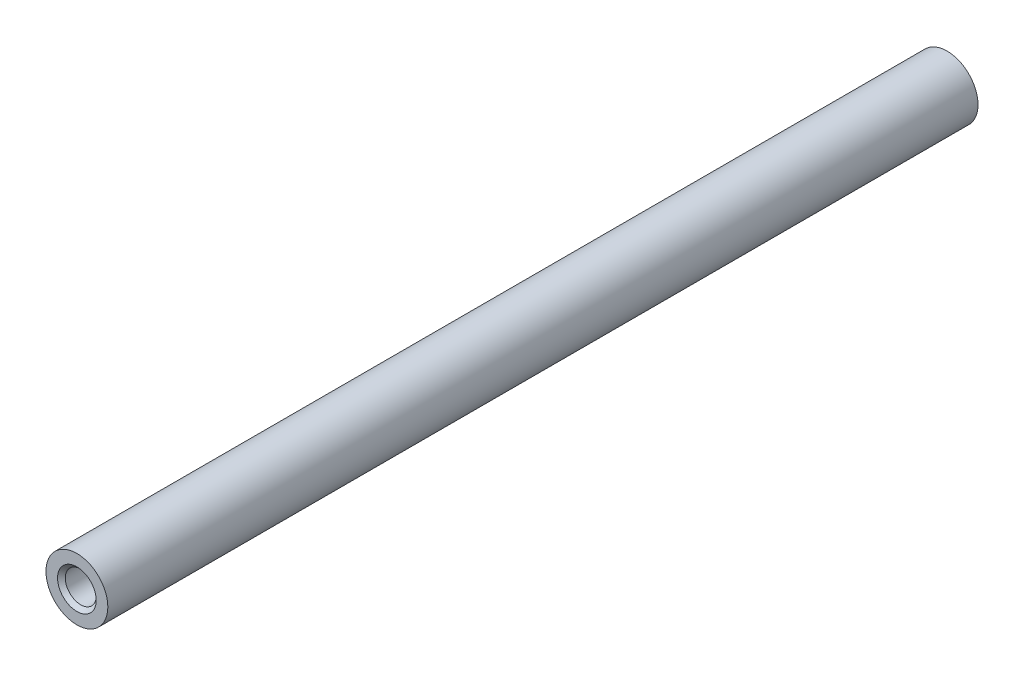
from build123d import *

# Parameters (mm, degrees)
SZKIC1_R                    = 8
SZKIC1_R_2                  = 4
DODANIE_WYCI_GNI_CIE1_DEPTH = 112.5
SZKIC2_R                    = 5
WYTNIJ_WYCI_GNI_CIE1_DEPTH  = 30
SFAZOWANIE1_SIZE            = 1


with BuildPart() as part:
    # Szkic1 → Dodanie-wyciągnięcie1 (new, symmetric)
    with BuildSketch(Plane.XY):
        Circle(SZKIC1_R)
        Circle(SZKIC1_R_2, mode=Mode.SUBTRACT)
    extrude(amount=DODANIE_WYCI_GNI_CIE1_DEPTH, both=True)

    # Szkic2 → Wytnij-wyciągnięcie1 (cut)
    with BuildSketch(Plane(origin=(0, 0, -112.5), x_dir=(-1, 0, 0), z_dir=(0, 0, -1))):
        Circle(SZKIC2_R)
    extrude(amount=-WYTNIJ_WYCI_GNI_CIE1_DEPTH, mode=Mode.SUBTRACT)

    # Sfazowanie1
    sfazowanie1_edges = [part.edges().sort_by_distance(p)[0] for p in [
        (-4, 0, 112.5),
    ]]
    chamfer(sfazowanie1_edges, length=SFAZOWANIE1_SIZE)


solid = part.part
